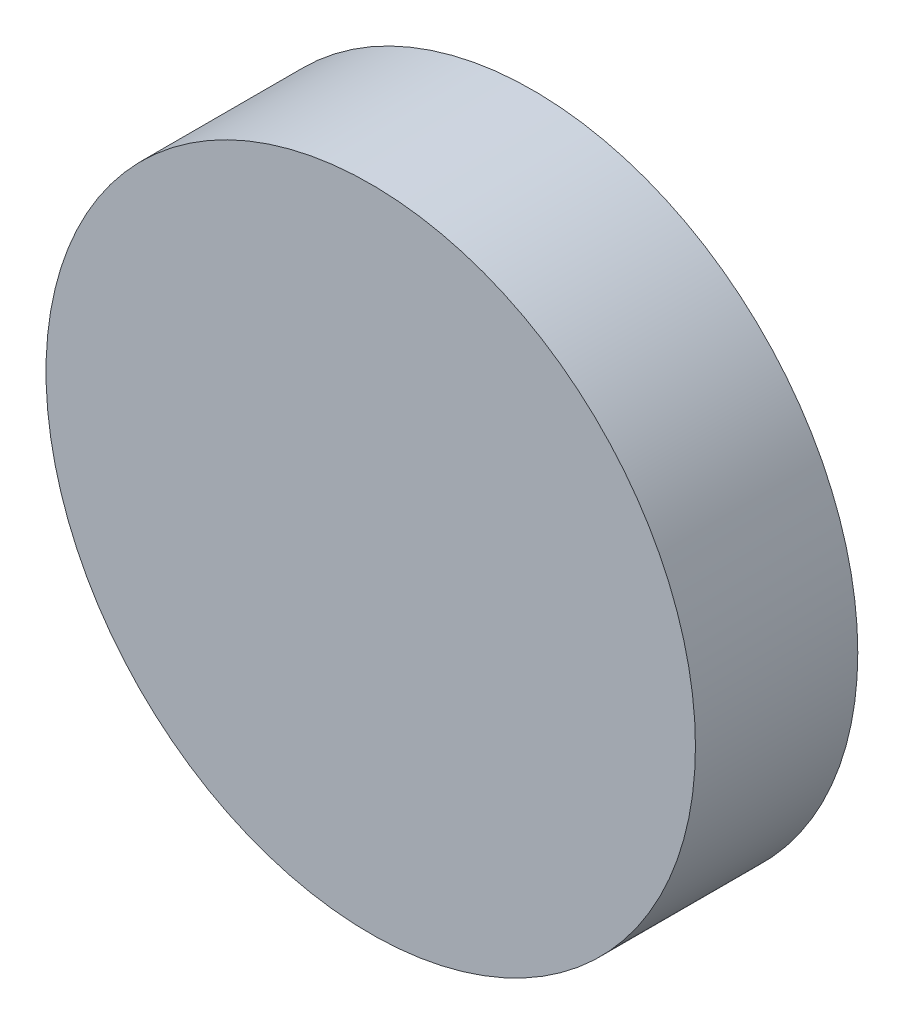
from build123d import *

# Parameters (mm, degrees)
SKETCH1_R           = 2
BOSS_EXTRUDE1_DEPTH = 1


with BuildPart() as part:
    # Sketch1 → Boss-Extrude1 (new body)
    with BuildSketch(Plane.XY):
        Circle(SKETCH1_R)
    extrude(amount=BOSS_EXTRUDE1_DEPTH)


solid = part.part
